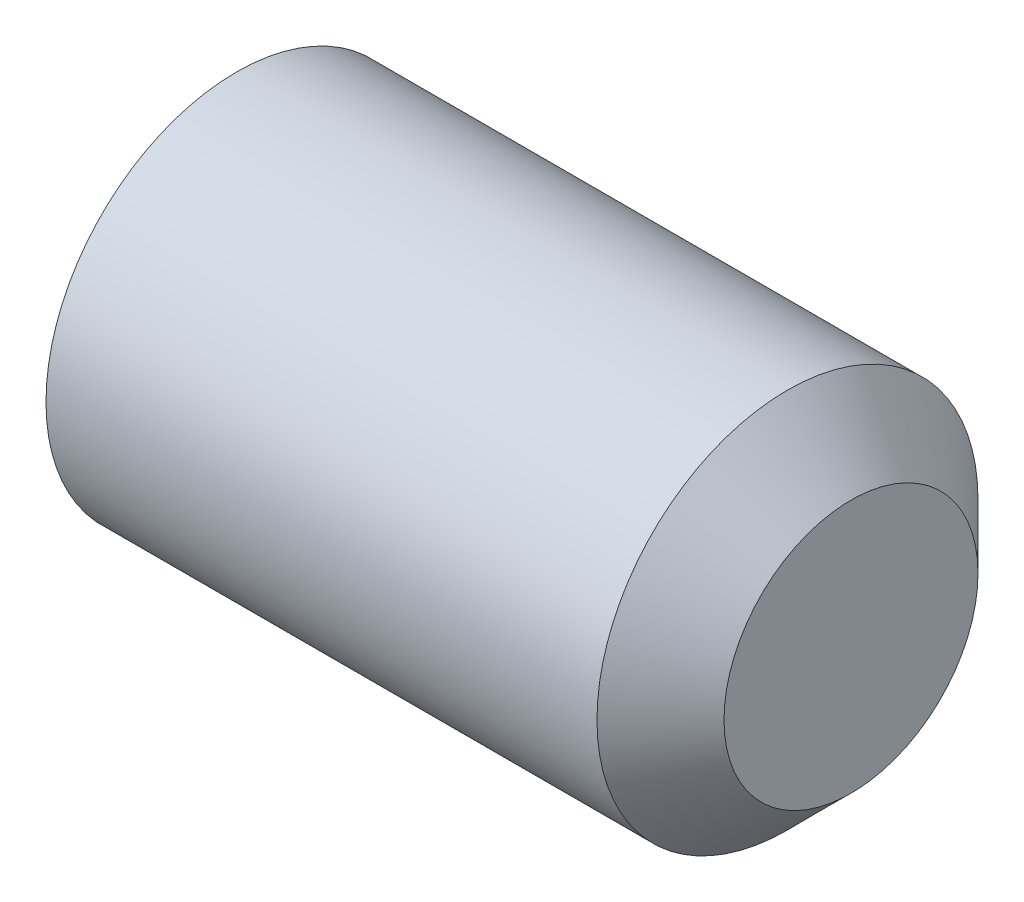
from build123d import *

# Parameters (mm, degrees)
HEX_2_DEPTH = 2


with BuildPart() as part:
    # BodySke → BaseBody (revolve)
    with BuildSketch(Plane.XY, mode=Mode.PRIVATE) as basebody_sk:
        Polygon((0, 0), (0, 1.2195), (0.161946751, 1.5), (4.5, 1.5), (5, 1), (5, 0), align=None)
    revolve(basebody_sk.sketch.rotate(Axis((-12.7, 0, 0), (1, 0, 0)), 90), axis=Axis((-12.7, 0, 0), (1, 0, 0)))

    # Sketch2 → Hex 2 (cut)
    with BuildSketch(Plane.ZY):
        Polygon((0.433012702, 0.75), (-0.433012702, 0.75), (-0.866025404, 0), (-0.433012702, -0.75), (0.433012702, -0.75), (0.866025404, 0), align=None)
    extrude(amount=-HEX_2_DEPTH, mode=Mode.SUBTRACT)


solid = part.part
